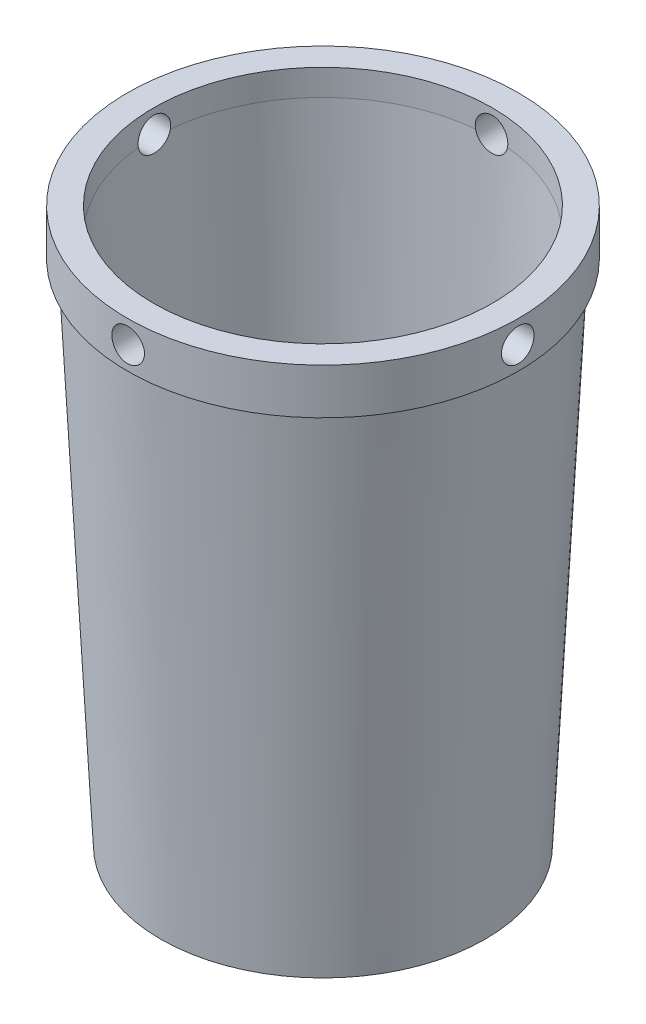
from build123d import *

# Parameters (mm, degrees)
CUT_EXTRUDE2_DEPTH = 45.212
CIRPATTERN2_COUNT  = 4


with BuildPart() as part:
    # Sketch2 → Revolve2 (revolve)
    with BuildSketch(Plane.XY, mode=Mode.PRIVATE) as revolve2_sk:
        Polygon((27.3304, 2.54), (27.3304, 0), (31.623, 0), (36.4998, 99.06), (38.0746, 99.06), (38.0746, 107.95), (32.9946, 107.95), (32.9946, 102.87), (29.083, 2.54), align=None)
    revolve(revolve2_sk.sketch.rotate(Axis((0, 0, 0), (0, 1, 0)), 90), axis=Axis((0, 0, 0), (0, 1, 0)))

    # Sketch5 → Cut-Extrude2 (cut)
    with BuildSketch(Plane.XY):
        with BuildLine():
            ThreePointArc((3.175, 103.505), (2.24506403, 105.75006403), (0, 106.68))
            Line((0, 106.68), (0, 100.33))
            ThreePointArc((0, 100.33), (2.24506403, 101.25993597), (3.175, 103.505))
        make_face()
        with BuildLine():
            Line((0, 100.33), (0, 106.68))
            ThreePointArc((0, 106.68), (-3.175, 103.505), (0, 100.33))
        make_face()
    cut_extrude2 = extrude(amount=-CUT_EXTRUDE2_DEPTH, mode=Mode.SUBTRACT)

    # CirPattern2: Cut-Extrude2 ×4 about axis
    cirpattern2_axis = Axis((0, 0, 0), (0, -1, 0))
    for i in range(1, CIRPATTERN2_COUNT):
        add(cut_extrude2.rotate(cirpattern2_axis, i * 360 / CIRPATTERN2_COUNT), mode=Mode.SUBTRACT)


solid = part.part
